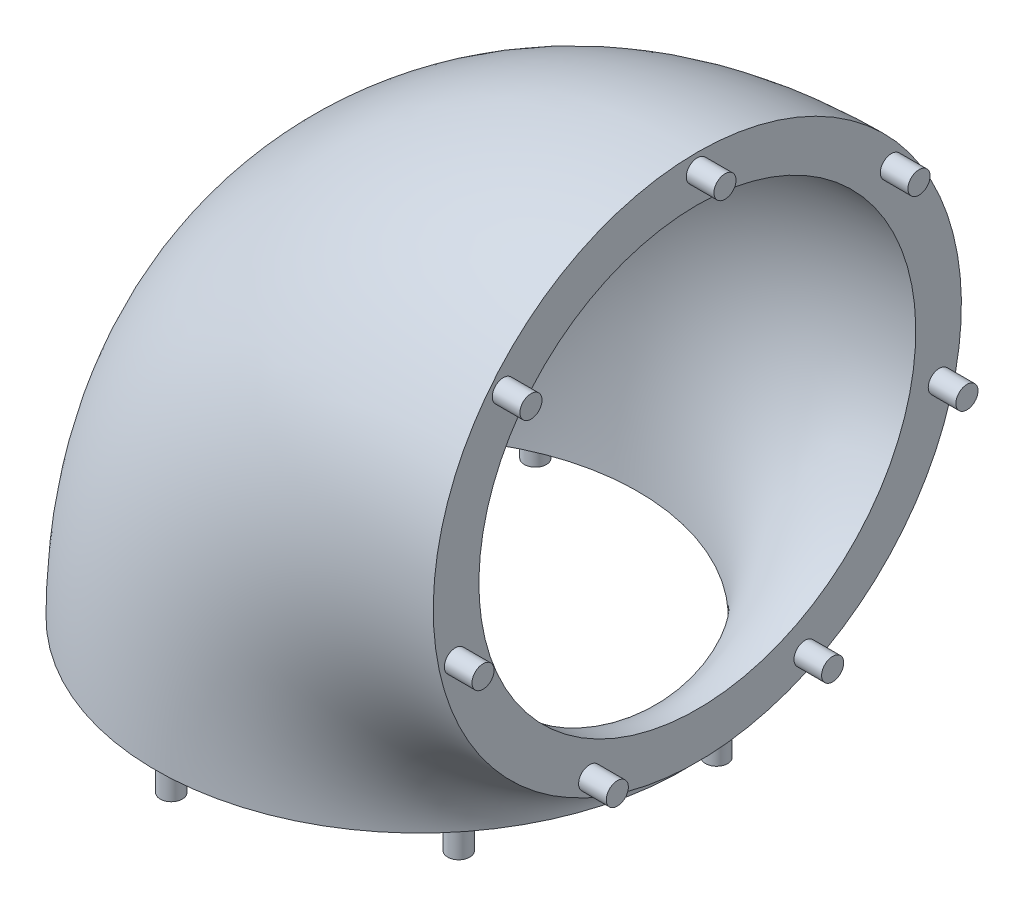
from build123d import *

# Parameters (mm, degrees)
CROQUIS4_R              = 95.5
CROQUIS4_R_2            = 79
CORTAR_EXTRUIR1_START   = -79
CROQUIS6_R              = 85
CROQUIS6_R_2            = 79
CORTAR_EXTRUIR1_DEPTH   = 79
CROQUIS7_R              = 85
CROQUIS7_R_2            = 79
CORTAR_EXTRUIR2_DEPTH   = 79
CROQUIS8_R              = 95.5
CORTAR_EXTRUIR3_DEPTH   = 79
CROQUIS10_R             = 4
SALIENTE_EXTRUIR3_DEPTH = 10
CROQUIS11_R             = 95.5
CORTAR_EXTRUIR4_DEPTH   = 351.943371662
CROQUIS12_R             = 4
SALIENTE_EXTRUIR4_DEPTH = 10


with BuildPart() as part:
    # Barrer5: sweep along a path in Croquis3
    with BuildLine(Plane.XY) as barrer5_path:
        Line((0, 0), (0, 79))
        ThreePointArc((0, 79), (29.435768491, 150.064231509), (100.5, 179.5))
        Line((100.5, 179.5), (179.5, 179.5))
    # Croquis4 → Barrer5 (sweep)
    with BuildSketch(Plane(origin=(0, 0, 0), x_dir=(1, 0, 0), z_dir=(0, 1, 0))):
        Circle(CROQUIS4_R)
        Circle(CROQUIS4_R_2, mode=Mode.SUBTRACT)
    sweep(path=barrer5_path.line)

    # Croquis6 → Cortar-Extruir1 (cut)
    with BuildSketch(Plane.XZ.offset(CORTAR_EXTRUIR1_START)):
        with Locations(Location((0, 0, 0), (0, 0, 270))):
            Circle(CROQUIS6_R)
        Circle(CROQUIS6_R_2, mode=Mode.SUBTRACT)
    extrude(amount=CORTAR_EXTRUIR1_DEPTH, mode=Mode.SUBTRACT)

    # Croquis7 → Cortar-Extruir2 (cut)
    with BuildSketch(Plane(origin=(179.5, 0, 0), x_dir=(0, 0, -1), z_dir=(1, 0, 0))):
        with Locations(Location((0, 179.5, 0), (0, 0, 90))):
            Circle(CROQUIS7_R)
        with Locations((0, 179.5)):
            Circle(CROQUIS7_R_2, mode=Mode.SUBTRACT)
    extrude(amount=-CORTAR_EXTRUIR2_DEPTH, mode=Mode.SUBTRACT)

    # Croquis8 → Cortar-Extruir3 (cut)
    with BuildSketch(Plane.XZ.offset(-79)):
        Circle(CROQUIS8_R)
    extrude(amount=CORTAR_EXTRUIR3_DEPTH, mode=Mode.SUBTRACT)

    # Croquis10 → Saliente-Extruir3 (add)
    with BuildSketch(Plane.XZ.offset(-79)):
        with Locations(Location((0, 89.75, 0), (0, 0, 270))):
            Circle(CROQUIS10_R)
        with Locations(Location((70.169375552, 55.958209717, 0), (0, 0, 270))):
            Circle(CROQUIS10_R)
        with Locations(Location((87.499780118, -19.971253823, 0), (0, 0, 270))):
            Circle(CROQUIS10_R)
        with Locations(Location((38.941065586, -80.861955894, 0), (0, 0, 270))):
            Circle(CROQUIS10_R)
        with Locations(Location((-38.941065586, -80.861955894, 0), (0, 0, 270))):
            Circle(CROQUIS10_R)
        with Locations(Location((-87.499780118, -19.971253823, 0), (0, 0, 270))):
            Circle(CROQUIS10_R)
        with Locations(Location((-70.169375552, 55.958209717, 0), (0, 0, 270))):
            Circle(CROQUIS10_R)
    extrude(amount=SALIENTE_EXTRUIR3_DEPTH)

    # Croquis11 → Cortar-Extruir4 (cut, through all)
    with BuildSketch(Plane(origin=(100.5, 0, 0), x_dir=(0, 0, -1), z_dir=(1, 0, 0))):
        with Locations((0, 179.5)):
            Circle(CROQUIS11_R)
    extrude(amount=CORTAR_EXTRUIR4_DEPTH, mode=Mode.SUBTRACT)

    # Croquis12 → Saliente-Extruir4 (add)
    with BuildSketch(Plane(origin=(100.5, 0, 0), x_dir=(0, 0, -1), z_dir=(1, 0, 0))):
        with Locations(Location((0, 269.25, 0), (0, 0, 90))):
            Circle(CROQUIS12_R)
        with Locations(Location((70.169375552, 235.458209717, 0), (0, 0, 90))):
            Circle(CROQUIS12_R)
        with Locations(Location((87.499780118, 159.528746177, 0), (0, 0, 90))):
            Circle(CROQUIS12_R)
        with Locations(Location((38.941065586, 98.638044106, 0), (0, 0, 90))):
            Circle(CROQUIS12_R)
        with Locations(Location((-38.941065586, 98.638044106, 0), (0, 0, 90))):
            Circle(CROQUIS12_R)
        with Locations(Location((-87.499780118, 159.528746177, 0), (0, 0, 90))):
            Circle(CROQUIS12_R)
        with Locations(Location((-70.169375552, 235.458209717, 0), (0, 0, 90))):
            Circle(CROQUIS12_R)
    extrude(amount=SALIENTE_EXTRUIR4_DEPTH)


solid = part.part
